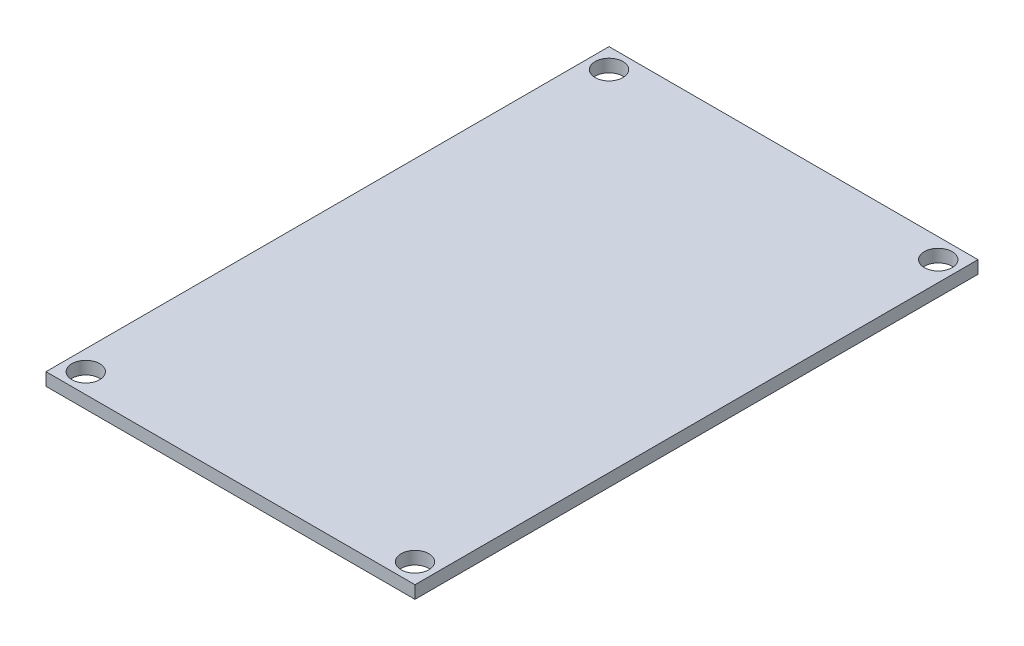
from build123d import *

# Parameters (mm, degrees)
SKETCH1_W           = 47.1424
SKETCH1_H           = 71.9328
BOSS_EXTRUDE1_DEPTH = 1.6256
SKETCH2_R           = 1.778
CUT_EXTRUDE1_DEPTH  = 1.6256


with BuildPart() as part:
    # Sketch1 → Boss-Extrude1 (new body)
    with BuildSketch(Plane(origin=(0, 0, 0), x_dir=(1, 0, 0), z_dir=(0, 1, 0))):
        Rectangle(SKETCH1_W, SKETCH1_H)
    extrude(amount=BOSS_EXTRUDE1_DEPTH)

    # Sketch2 → Cut-Extrude1 (cut)
    with BuildSketch(Plane(origin=(0, 1.6256, 0), x_dir=(1, 0, 0), z_dir=(0, 1, 0))):
        with Locations(Location((-21.0312, 33.4264, 0), (0, 0, 270))):
            Circle(SKETCH2_R)
        with Locations(Location((21.0312, 33.4264, 0), (0, 0, 270))):
            Circle(SKETCH2_R)
        with Locations(Location((-21.0312, -33.4264, 0), (0, 0, 270))):
            Circle(SKETCH2_R)
        with Locations(Location((21.0312, -33.4264, 0), (0, 0, 270))):
            Circle(SKETCH2_R)
    extrude(amount=-CUT_EXTRUDE1_DEPTH, mode=Mode.SUBTRACT)


solid = part.part
